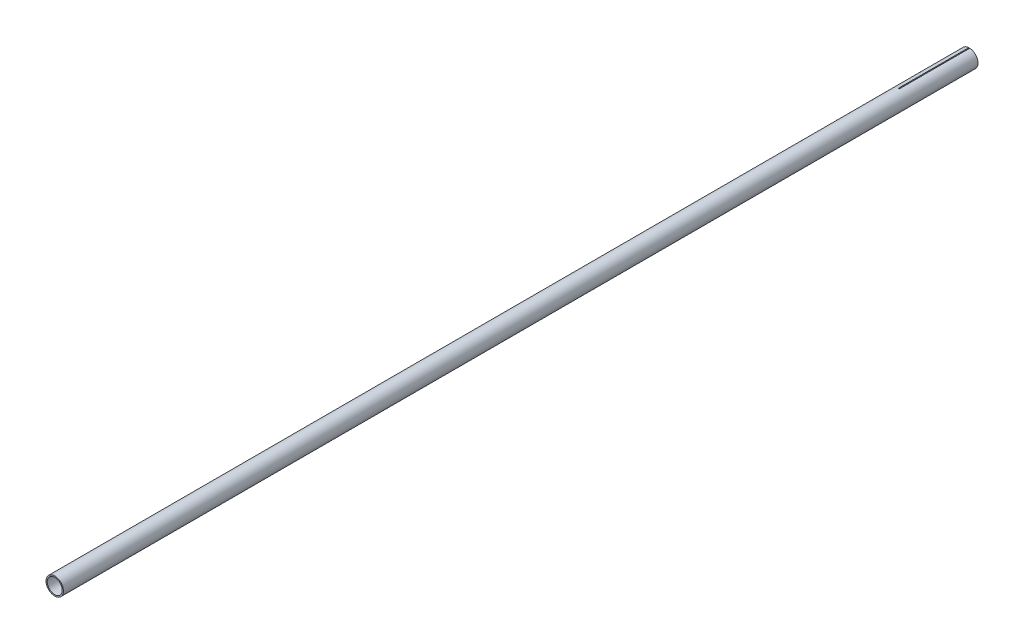
from build123d import *

# Parameters (mm, degrees)
SKETCH1_R           = 17.46
SKETCH1_R_2         = 15
BOSS_EXTRUDE1_DEPTH = 1828.8
SKETCH4_W           = 2.08
SKETCH4_H           = 50
CUT_EXTRUDE2_DEPTH  = 141


with BuildPart() as part:
    # Sketch1 → Boss-Extrude1 (new body)
    with BuildSketch(Plane.XY):
        Circle(SKETCH1_R)
        Circle(SKETCH1_R_2, mode=Mode.SUBTRACT)
    extrude(amount=BOSS_EXTRUDE1_DEPTH)

    # Sketch4 → Cut-Extrude2 (cut)
    with BuildSketch(Plane.XY):
        Rectangle(SKETCH4_W, SKETCH4_H)
    extrude(amount=CUT_EXTRUDE2_DEPTH, mode=Mode.SUBTRACT)


solid = part.part
